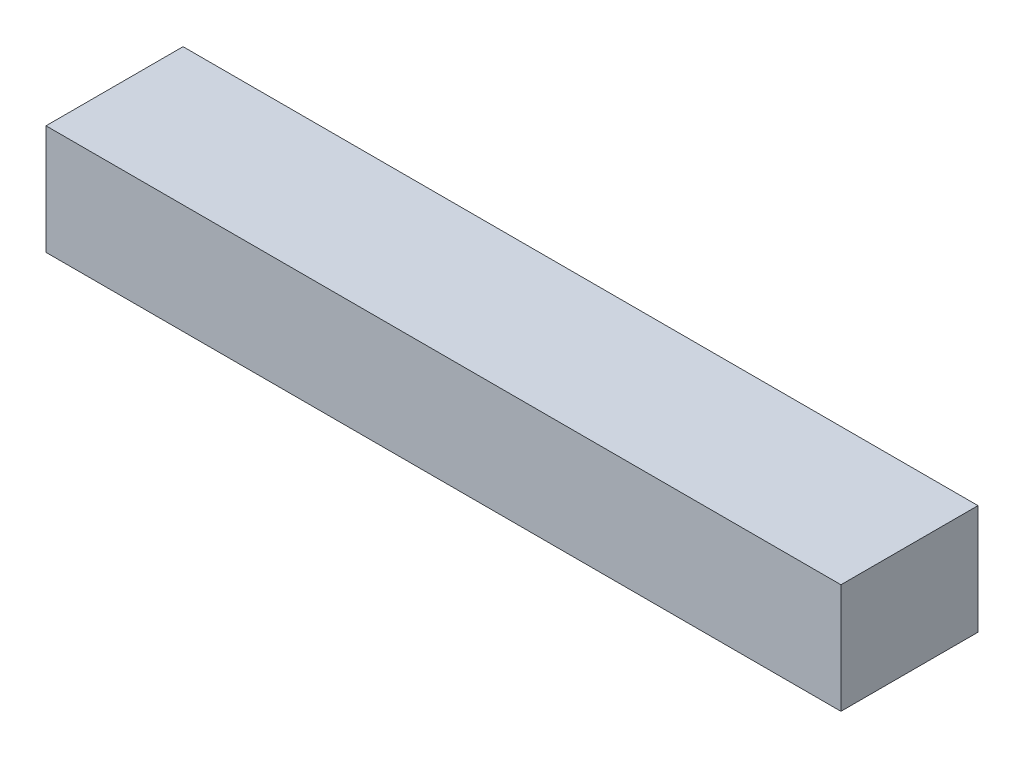
from build123d import *

# Parameters (mm, degrees)
SKETCH1_W           = 73.66
SKETCH1_H           = 12.7
BOSS_EXTRUDE1_DEPTH = 10.16


with BuildPart() as part:
    # Sketch1 → Boss-Extrude1 (new body)
    with BuildSketch(Plane(origin=(0, 0, 0), x_dir=(1, 0, 0), z_dir=(0, 1, 0))):
        with Locations((36.83, 6.35)):
            Rectangle(SKETCH1_W, SKETCH1_H)
    extrude(amount=BOSS_EXTRUDE1_DEPTH)


solid = part.part
